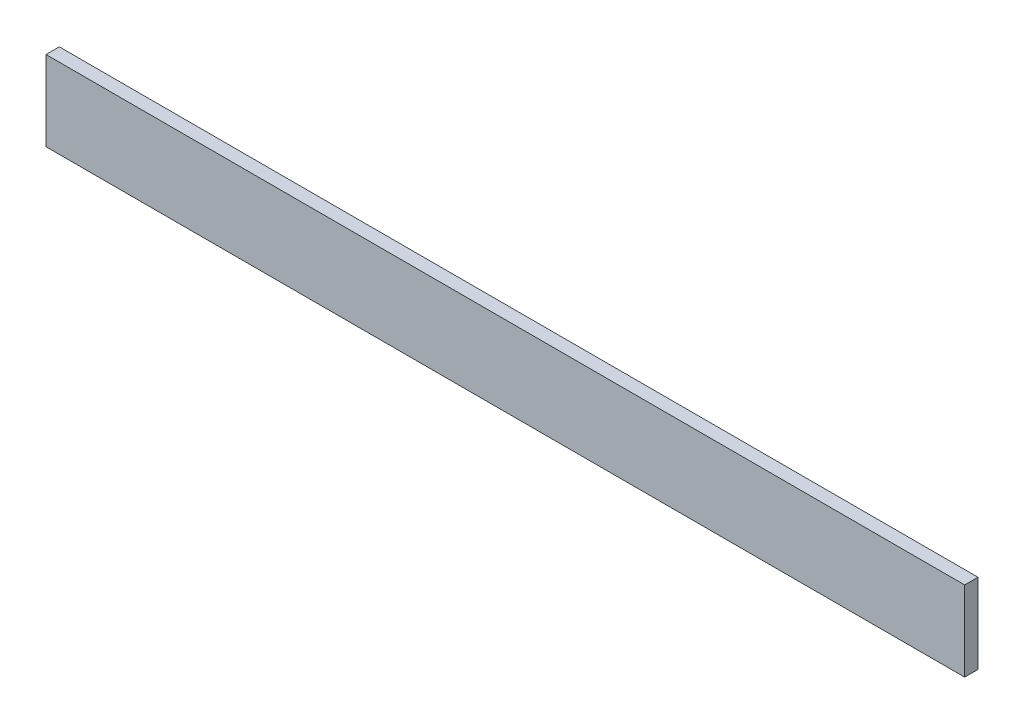
from build123d import *

# Parameters (mm, degrees)
SKETCH1_W           = 50.8
SKETCH1_H           = 304.8
BOSS_EXTRUDE1_DEPTH = 3505.2


with BuildPart() as part:
    # Sketch1 → Boss-Extrude1 (new body)
    with BuildSketch(Plane(origin=(0, 0, 0), x_dir=(0, 0, -1), z_dir=(1, 0, 0))):
        with Locations((25.4, 152.4)):
            Rectangle(SKETCH1_W, SKETCH1_H)
    extrude(amount=BOSS_EXTRUDE1_DEPTH)


solid = part.part
